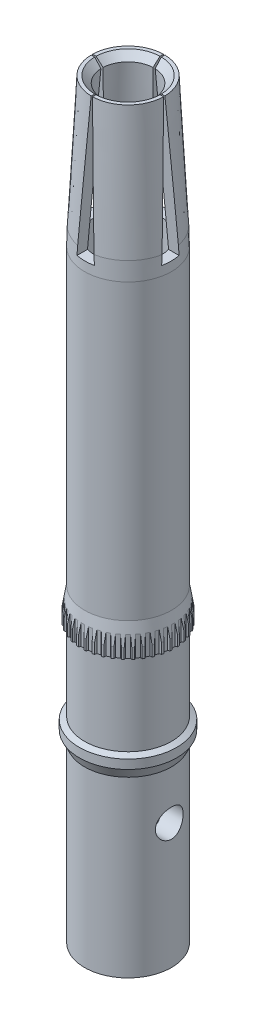
from build123d import *

# Parameters (mm, degrees)
SKETCH3_OUTSIDE_W  = 5.596
SKETCH3_OUTSIDE_H  = 5.596
CUT_EXTRUDE1_DEPTH = 1
CUT_EXTRUDE2_DEPTH = 1
CIRPATTERN1_COUNT  = 2
CIRPATTERN1_ANGLE  = 90
SKETCH5_R          = 0.2
CUT_EXTRUDE3_DEPTH = 10


with BuildPart() as part:
    # Sketch1 → Revolve1 (revolve)
    with BuildSketch(Plane.XY, mode=Mode.PRIVATE) as revolve1_sk:
        Polygon((-0.625, 0), (-0.35, 0), (-0.35, 2.45), (0, 2.45), (0, 7.51459144), (-0.47499965, 7.8), (-0.47499965, 8.8), (-0.37495839, 10.7049798), (-0.46997859, 10.8), (-0.52018469, 10.8), (-0.61814767, 8.93075017), (-0.625, 8.66907039), (-0.625, 4.45), (-0.67386233, 4.15), (-0.67386233, 4), (-0.625, 4), (-0.625, 2.8175), (-0.7, 2.78), (-0.7, 2.65), (-0.625, 2.5), align=None)
    revolve(revolve1_sk.sketch.rotate(Axis((0, 0, 0), (0, 1, 0)), 270), axis=Axis((0, 0, 0), (0, 1, 0)))

    # Sketch3 outside → Cut-Extrude1 (cut)
    with BuildSketch(Plane(origin=(0, 4, -4), x_dir=(1, 0, 0), z_dir=(0, -1, 0))):
        with Locations((0, 4)):
            Rectangle(SKETCH3_OUTSIDE_W, SKETCH3_OUTSIDE_H)
        with BuildLine():
            Line((0.673862334, 3.960826606), (0.64951457, 3.974883794))
            ThreePointArc((0.64951457, 3.974883794), (0.65, 4), (0.64951457, 4.025116206))
            Line((0.64951457, 4.025116206), (0.673862334, 4.039173394))
            ThreePointArc((0.673862334, 4.039173394), (0.6729192, 4.05295989), (0.671694039, 4.066724189))
            Line((0.671694039, 4.066724189), (0.645447008, 4.076799481))
            ThreePointArc((0.645447008, 4.076799481), (0.641997421, 4.101682402), (0.637588927, 4.126413448))
            Line((0.637588927, 4.126413448), (0.659437902, 4.144106398))
            ThreePointArc((0.659437902, 4.144106398), (0.656349696, 4.157575621), (0.652986408, 4.170978801))
            Line((0.652986408, 4.170978801), (0.625486398, 4.176824109))
            ThreePointArc((0.625486398, 4.176824109), (0.618186736, 4.200861046), (0.60996373, 4.224597971))
            Line((0.60996373, 4.224597971), (0.628775919, 4.245491025))
            ThreePointArc((0.628775919, 4.245491025), (0.623618684, 4.258311317), (0.618200085, 4.271023348))
            Line((0.618200085, 4.271023348), (0.590124238, 4.272494741))
            ThreePointArc((0.590124238, 4.272494741), (0.579154241, 4.295093825), (0.5673192, 4.317252147))
            Line((0.5673192, 4.317252147), (0.582631387, 4.340830847))
            ThreePointArc((0.582631387, 4.340830847), (0.575532111, 4.352686531), (0.568191623, 4.364394401))
            Line((0.568191623, 4.364394401), (0.54023126, 4.361455648))
            ThreePointArc((0.54023126, 4.361455648), (0.525861046, 4.382060414), (0.51070539, 4.402094522))
            Line((0.51070539, 4.402094522), (0.522140537, 4.427778283))
            ThreePointArc((0.522140537, 4.427778283), (0.513274027, 4.438377433), (0.504192399, 4.448792853))
            Line((0.504192399, 4.448792853), (0.477035996, 4.441516317))
            ThreePointArc((0.477035996, 4.441516317), (0.459619408, 4.459619408), (0.441516317, 4.477035996))
            Line((0.441516317, 4.477035996), (0.448792853, 4.504192399))
            ThreePointArc((0.448792853, 4.504192399), (0.438377433, 4.513274027), (0.427778283, 4.522140537))
            Line((0.427778283, 4.522140537), (0.402094522, 4.51070539))
            ThreePointArc((0.402094522, 4.51070539), (0.382060414, 4.525861046), (0.361455648, 4.54023126))
            Line((0.361455648, 4.54023126), (0.364394401, 4.568191623))
            ThreePointArc((0.364394401, 4.568191623), (0.352686531, 4.575532111), (0.340830847, 4.582631387))
            Line((0.340830847, 4.582631387), (0.317252147, 4.5673192))
            ThreePointArc((0.317252147, 4.5673192), (0.295093825, 4.579154241), (0.272494741, 4.590124238))
            Line((0.272494741, 4.590124238), (0.271023348, 4.618200085))
            ThreePointArc((0.271023348, 4.618200085), (0.258311317, 4.623618684), (0.245491025, 4.628775919))
            Line((0.245491025, 4.628775919), (0.224597971, 4.60996373))
            ThreePointArc((0.224597971, 4.60996373), (0.200861046, 4.618186736), (0.176824109, 4.625486398))
            Line((0.176824109, 4.625486398), (0.170978801, 4.652986408))
            ThreePointArc((0.170978801, 4.652986408), (0.157575621, 4.656349696), (0.144106398, 4.659437902))
            Line((0.144106398, 4.659437902), (0.126413448, 4.637588927))
            ThreePointArc((0.126413448, 4.637588927), (0.101682402, 4.641997421), (0.076799481, 4.645447008))
            Line((0.076799481, 4.645447008), (0.066724189, 4.671694039))
            ThreePointArc((0.066724189, 4.671694039), (0.05295989, 4.6729192), (0.039173394, 4.673862334))
            Line((0.039173394, 4.673862334), (0.025116206, 4.64951457))
            ThreePointArc((0.025116206, 4.64951457), (0, 4.65), (-0.025116206, 4.64951457))
            Line((-0.025116206, 4.64951457), (-0.039173394, 4.673862334))
            ThreePointArc((-0.039173394, 4.673862334), (-0.05295989, 4.6729192), (-0.066724189, 4.671694039))
            Line((-0.066724189, 4.671694039), (-0.076799481, 4.645447008))
            ThreePointArc((-0.076799481, 4.645447008), (-0.101682402, 4.641997421), (-0.126413448, 4.637588927))
            Line((-0.126413448, 4.637588927), (-0.144106398, 4.659437902))
            ThreePointArc((-0.144106398, 4.659437902), (-0.157575621, 4.656349696), (-0.170978801, 4.652986408))
            Line((-0.170978801, 4.652986408), (-0.176824109, 4.625486398))
            ThreePointArc((-0.176824109, 4.625486398), (-0.200861046, 4.618186736), (-0.224597971, 4.60996373))
            Line((-0.224597971, 4.60996373), (-0.245491025, 4.628775919))
            ThreePointArc((-0.245491025, 4.628775919), (-0.258311317, 4.623618684), (-0.271023348, 4.618200085))
            Line((-0.271023348, 4.618200085), (-0.272494741, 4.590124238))
            ThreePointArc((-0.272494741, 4.590124238), (-0.295093825, 4.579154241), (-0.317252147, 4.5673192))
            Line((-0.317252147, 4.5673192), (-0.340830847, 4.582631387))
            ThreePointArc((-0.340830847, 4.582631387), (-0.352686531, 4.575532111), (-0.364394401, 4.568191623))
            Line((-0.364394401, 4.568191623), (-0.361455648, 4.54023126))
            ThreePointArc((-0.361455648, 4.54023126), (-0.382060414, 4.525861046), (-0.402094522, 4.51070539))
            Line((-0.402094522, 4.51070539), (-0.427778283, 4.522140537))
            ThreePointArc((-0.427778283, 4.522140537), (-0.438377433, 4.513274027), (-0.448792853, 4.504192399))
            Line((-0.448792853, 4.504192399), (-0.441516317, 4.477035996))
            ThreePointArc((-0.441516317, 4.477035996), (-0.459619408, 4.459619408), (-0.477035996, 4.441516317))
            Line((-0.477035996, 4.441516317), (-0.504192399, 4.448792853))
            ThreePointArc((-0.504192399, 4.448792853), (-0.513274027, 4.438377433), (-0.522140537, 4.427778283))
            Line((-0.522140537, 4.427778283), (-0.51070539, 4.402094522))
            ThreePointArc((-0.51070539, 4.402094522), (-0.525861046, 4.382060414), (-0.54023126, 4.361455648))
            Line((-0.54023126, 4.361455648), (-0.568191623, 4.364394401))
            ThreePointArc((-0.568191623, 4.364394401), (-0.575532111, 4.352686531), (-0.582631387, 4.340830847))
            Line((-0.582631387, 4.340830847), (-0.5673192, 4.317252147))
            ThreePointArc((-0.5673192, 4.317252147), (-0.579154241, 4.295093825), (-0.590124238, 4.272494741))
            Line((-0.590124238, 4.272494741), (-0.618200085, 4.271023348))
            ThreePointArc((-0.618200085, 4.271023348), (-0.623618684, 4.258311317), (-0.628775919, 4.245491025))
            Line((-0.628775919, 4.245491025), (-0.60996373, 4.224597971))
            ThreePointArc((-0.60996373, 4.224597971), (-0.618186736, 4.200861046), (-0.625486398, 4.176824109))
            Line((-0.625486398, 4.176824109), (-0.652986408, 4.170978801))
            ThreePointArc((-0.652986408, 4.170978801), (-0.656349696, 4.157575621), (-0.659437902, 4.144106398))
            Line((-0.659437902, 4.144106398), (-0.637588927, 4.126413448))
            ThreePointArc((-0.637588927, 4.126413448), (-0.641997421, 4.101682402), (-0.645447008, 4.076799481))
            Line((-0.645447008, 4.076799481), (-0.671694039, 4.066724189))
            ThreePointArc((-0.671694039, 4.066724189), (-0.6729192, 4.05295989), (-0.673862334, 4.039173394))
            Line((-0.673862334, 4.039173394), (-0.64951457, 4.025116206))
            ThreePointArc((-0.64951457, 4.025116206), (-0.65, 4), (-0.64951457, 3.974883794))
            Line((-0.64951457, 3.974883794), (-0.673862334, 3.960826606))
            ThreePointArc((-0.673862334, 3.960826606), (-0.6729192, 3.94704011), (-0.671694039, 3.933275811))
            Line((-0.671694039, 3.933275811), (-0.645447008, 3.923200519))
            ThreePointArc((-0.645447008, 3.923200519), (-0.641997421, 3.898317598), (-0.637588927, 3.873586552))
            Line((-0.637588927, 3.873586552), (-0.659437902, 3.855893602))
            ThreePointArc((-0.659437902, 3.855893602), (-0.656349696, 3.842424379), (-0.652986408, 3.829021199))
            Line((-0.652986408, 3.829021199), (-0.625486398, 3.823175891))
            ThreePointArc((-0.625486398, 3.823175891), (-0.618186736, 3.799138954), (-0.60996373, 3.775402029))
            Line((-0.60996373, 3.775402029), (-0.628775919, 3.754508975))
            ThreePointArc((-0.628775919, 3.754508975), (-0.623618684, 3.741688683), (-0.618200085, 3.728976652))
            Line((-0.618200085, 3.728976652), (-0.590124238, 3.727505259))
            ThreePointArc((-0.590124238, 3.727505259), (-0.579154241, 3.704906175), (-0.5673192, 3.682747853))
            Line((-0.5673192, 3.682747853), (-0.582631387, 3.659169153))
            ThreePointArc((-0.582631387, 3.659169153), (-0.575532111, 3.647313469), (-0.568191623, 3.635605599))
            Line((-0.568191623, 3.635605599), (-0.54023126, 3.638544352))
            ThreePointArc((-0.54023126, 3.638544352), (-0.525861046, 3.617939586), (-0.51070539, 3.597905478))
            Line((-0.51070539, 3.597905478), (-0.522140537, 3.572221717))
            ThreePointArc((-0.522140537, 3.572221717), (-0.513274027, 3.561622567), (-0.504192399, 3.551207147))
            Line((-0.504192399, 3.551207147), (-0.477035996, 3.558483683))
            ThreePointArc((-0.477035996, 3.558483683), (-0.459619408, 3.540380592), (-0.441516317, 3.522964004))
            Line((-0.441516317, 3.522964004), (-0.448792853, 3.495807601))
            ThreePointArc((-0.448792853, 3.495807601), (-0.438377433, 3.486725973), (-0.427778283, 3.477859463))
            Line((-0.427778283, 3.477859463), (-0.402094522, 3.48929461))
            ThreePointArc((-0.402094522, 3.48929461), (-0.382060414, 3.474138954), (-0.361455648, 3.45976874))
            Line((-0.361455648, 3.45976874), (-0.364394401, 3.431808377))
            ThreePointArc((-0.364394401, 3.431808377), (-0.352686531, 3.424467889), (-0.340830847, 3.417368613))
            Line((-0.340830847, 3.417368613), (-0.317252147, 3.4326808))
            ThreePointArc((-0.317252147, 3.4326808), (-0.295093825, 3.420845759), (-0.272494741, 3.409875762))
            Line((-0.272494741, 3.409875762), (-0.271023348, 3.381799915))
            ThreePointArc((-0.271023348, 3.381799915), (-0.258311317, 3.376381316), (-0.245491025, 3.371224081))
            Line((-0.245491025, 3.371224081), (-0.224597971, 3.39003627))
            ThreePointArc((-0.224597971, 3.39003627), (-0.200861046, 3.381813264), (-0.176824109, 3.374513602))
            Line((-0.176824109, 3.374513602), (-0.170978801, 3.347013592))
            ThreePointArc((-0.170978801, 3.347013592), (-0.157575621, 3.343650304), (-0.144106398, 3.340562098))
            Line((-0.144106398, 3.340562098), (-0.126413448, 3.362411073))
            ThreePointArc((-0.126413448, 3.362411073), (-0.101682402, 3.358002579), (-0.076799481, 3.354552992))
            Line((-0.076799481, 3.354552992), (-0.066724189, 3.328305961))
            ThreePointArc((-0.066724189, 3.328305961), (-0.05295989, 3.3270808), (-0.039173394, 3.326137666))
            Line((-0.039173394, 3.326137666), (-0.025116206, 3.35048543))
            ThreePointArc((-0.025116206, 3.35048543), (0, 3.35), (0.025116206, 3.35048543))
            Line((0.025116206, 3.35048543), (0.039173394, 3.326137666))
            ThreePointArc((0.039173394, 3.326137666), (0.05295989, 3.3270808), (0.066724189, 3.328305961))
            Line((0.066724189, 3.328305961), (0.076799481, 3.354552992))
            ThreePointArc((0.076799481, 3.354552992), (0.101682402, 3.358002579), (0.126413448, 3.362411073))
            Line((0.126413448, 3.362411073), (0.144106398, 3.340562098))
            ThreePointArc((0.144106398, 3.340562098), (0.157575621, 3.343650304), (0.170978801, 3.347013592))
            Line((0.170978801, 3.347013592), (0.176824109, 3.374513602))
            ThreePointArc((0.176824109, 3.374513602), (0.200861046, 3.381813264), (0.224597971, 3.39003627))
            Line((0.224597971, 3.39003627), (0.245491025, 3.371224081))
            ThreePointArc((0.245491025, 3.371224081), (0.258311317, 3.376381316), (0.271023348, 3.381799915))
            Line((0.271023348, 3.381799915), (0.272494741, 3.409875762))
            ThreePointArc((0.272494741, 3.409875762), (0.295093825, 3.420845759), (0.317252147, 3.4326808))
            Line((0.317252147, 3.4326808), (0.340830847, 3.417368613))
            ThreePointArc((0.340830847, 3.417368613), (0.352686531, 3.424467889), (0.364394401, 3.431808377))
            Line((0.364394401, 3.431808377), (0.361455648, 3.45976874))
            ThreePointArc((0.361455648, 3.45976874), (0.382060414, 3.474138954), (0.402094522, 3.48929461))
            Line((0.402094522, 3.48929461), (0.427778283, 3.477859463))
            ThreePointArc((0.427778283, 3.477859463), (0.438377433, 3.486725973), (0.448792853, 3.495807601))
            Line((0.448792853, 3.495807601), (0.441516317, 3.522964004))
            ThreePointArc((0.441516317, 3.522964004), (0.459619408, 3.540380592), (0.477035996, 3.558483683))
            Line((0.477035996, 3.558483683), (0.504192399, 3.551207147))
            ThreePointArc((0.504192399, 3.551207147), (0.513274027, 3.561622567), (0.522140537, 3.572221717))
            Line((0.522140537, 3.572221717), (0.51070539, 3.597905478))
            ThreePointArc((0.51070539, 3.597905478), (0.525861046, 3.617939586), (0.54023126, 3.638544352))
            Line((0.54023126, 3.638544352), (0.568191623, 3.635605599))
            ThreePointArc((0.568191623, 3.635605599), (0.575532111, 3.647313469), (0.582631387, 3.659169153))
            Line((0.582631387, 3.659169153), (0.5673192, 3.682747853))
            ThreePointArc((0.5673192, 3.682747853), (0.579154241, 3.704906175), (0.590124238, 3.727505259))
            Line((0.590124238, 3.727505259), (0.618200085, 3.728976652))
            ThreePointArc((0.618200085, 3.728976652), (0.623618684, 3.741688683), (0.628775919, 3.754508975))
            Line((0.628775919, 3.754508975), (0.60996373, 3.775402029))
            ThreePointArc((0.60996373, 3.775402029), (0.618186736, 3.799138954), (0.625486398, 3.823175891))
            Line((0.625486398, 3.823175891), (0.652986408, 3.829021199))
            ThreePointArc((0.652986408, 3.829021199), (0.656349696, 3.842424379), (0.659437902, 3.855893602))
            Line((0.659437902, 3.855893602), (0.637588927, 3.873586552))
            ThreePointArc((0.637588927, 3.873586552), (0.641997421, 3.898317598), (0.645447008, 3.923200519))
            Line((0.645447008, 3.923200519), (0.671694039, 3.933275811))
            ThreePointArc((0.671694039, 3.933275811), (0.6729192, 3.94704011), (0.673862334, 3.960826606))
        make_face(mode=Mode.SUBTRACT)
    extrude(amount=-CUT_EXTRUDE1_DEPTH, mode=Mode.SUBTRACT)

    # Sketch4 → Cut-Extrude2 (cut, symmetric)
    with BuildSketch(Plane.XY):
        Polygon((-0.01, 10.8), (-0.125, 8.8), (0.125, 8.8), (0.01, 10.8), align=None)
    cut_extrude2 = extrude(amount=CUT_EXTRUDE2_DEPTH, both=True, mode=Mode.SUBTRACT)

    # CirPattern1: Cut-Extrude2 ×2 about axis
    cirpattern1_axis = Axis((0, 10.8, 0), (0, -1, 0))
    for i in range(1, CIRPATTERN1_COUNT):
        add(cut_extrude2.rotate(cirpattern1_axis, i * CIRPATTERN1_ANGLE / (CIRPATTERN1_COUNT - 1)), mode=Mode.SUBTRACT)

    # Sketch5 → Cut-Extrude3 (cut)
    with BuildSketch(Plane(origin=(0, 0, 0), x_dir=(0, 0, -1), z_dir=(1, 0, 0))):
        with Locations(Location((0, 1.8, 0), (0, 0, 180))):
            Circle(SKETCH5_R)
    extrude(amount=CUT_EXTRUDE3_DEPTH, mode=Mode.SUBTRACT)


solid = part.part
